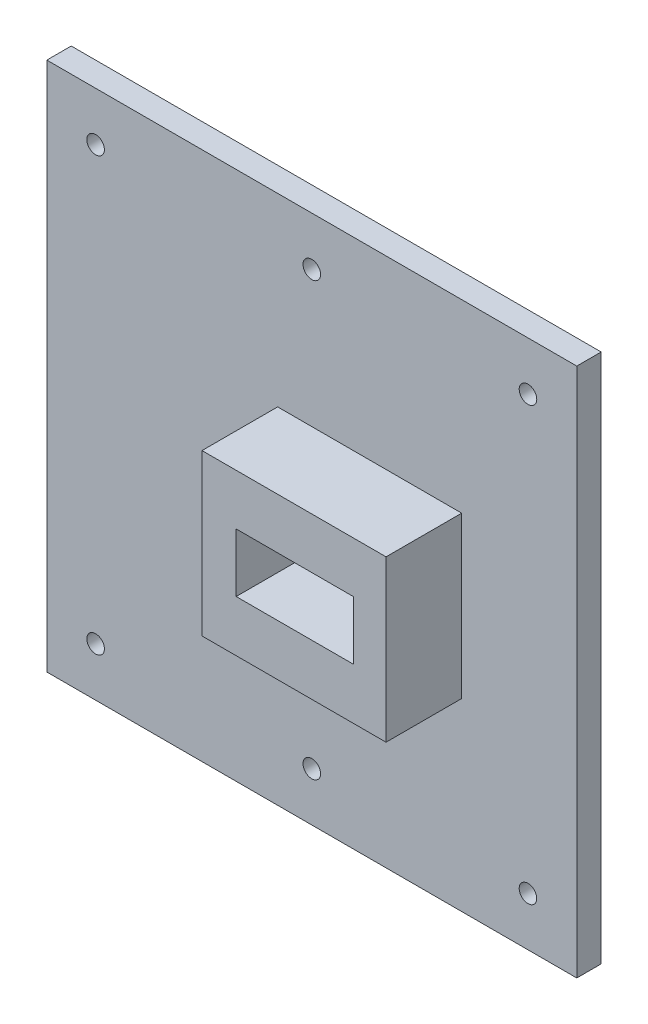
from build123d import *

# Parameters (mm, degrees)
ESQUISSE1_R        = 1.8
BOSS_EXTRU_1_DEPTH = 5
ESQUISSE7_W        = 37.712200448
ESQUISSE7_H        = 32.898703175
BOSS_EXTRU_2_DEPTH = 15.5


with BuildPart() as part:
    # Esquisse1 → Boss.-Extru.1 (new body)
    with BuildSketch(Plane(origin=(0, 0, 0), x_dir=(-1, 0, 0), z_dir=(0, 0, 1))):
        Polygon((96.824454852, 121.477817805), (96.824454852, 131.477817805), (-1.765545148, 131.477817805), (-11.765545148, 131.477817805), (-11.765545148, 22.887817805), (-1.765545148, 22.887817805), (42.529454852, 22.887817805), (86.824454852, 22.887817805), (96.824454852, 22.887817805), align=None)
        with BuildLine():
            ThreePointArc((0.034454852, 32.887817805), (-0.492752942, 31.615025599), (-1.765545148, 31.087817805))
            ThreePointArc((-1.765545148, 31.087817805), (-3.038337355, 34.160610011), (0.034454852, 32.887817805))
        make_face(mode=Mode.SUBTRACT)
        with BuildLine():
            ThreePointArc((44.329454852, 32.887817805), (43.802247058, 31.615025599), (42.529454852, 31.087817805))
            ThreePointArc((42.529454852, 31.087817805), (40.729454852, 32.887817805), (42.529454852, 34.687817805))
            ThreePointArc((42.529454852, 34.687817805), (43.802247058, 34.160610011), (44.329454852, 32.887817805))
        make_face(mode=Mode.SUBTRACT)
        with BuildLine():
            ThreePointArc((88.624454852, 32.887817805), (88.097247058, 31.615025599), (86.824454852, 31.087817805))
            ThreePointArc((86.824454852, 31.087817805), (85.551662645, 34.160610011), (88.624454852, 32.887817805))
        make_face(mode=Mode.SUBTRACT)
        with BuildLine():
            ThreePointArc((0.034454852, 121.477817805), (-3.038337355, 120.205025599), (-1.765545148, 123.277817805))
            ThreePointArc((-1.765545148, 123.277817805), (-0.492752942, 122.750610011), (0.034454852, 121.477817805))
        make_face(mode=Mode.SUBTRACT)
        with BuildLine():
            ThreePointArc((44.329454852, 121.477817805), (43.802247058, 120.205025599), (42.529454852, 119.677817805))
            ThreePointArc((42.529454852, 119.677817805), (41.256662645, 122.750610011), (44.329454852, 121.477817805))
        make_face(mode=Mode.SUBTRACT)
        with Locations((86.824454852, 121.477817805)):
            Circle(ESQUISSE1_R, mode=Mode.SUBTRACT)
    extrude(amount=BOSS_EXTRU_1_DEPTH)

    # Esquisse7 → Boss.-Extru.2 (add)
    with BuildSketch(Plane.XY.offset(5)):
        with Locations((-30.673354628, -77.229731143)):
            Rectangle(ESQUISSE7_W, ESQUISSE7_H)
        Polygon((-42.529454852, -77.182817805), (-42.529454852, -71.182817805), (-18.529454852, -71.182817805), (-18.529454852, -83.182817805), (-42.529454852, -83.182817805), align=None, mode=Mode.SUBTRACT)
    extrude(amount=BOSS_EXTRU_2_DEPTH)


solid = part.part
